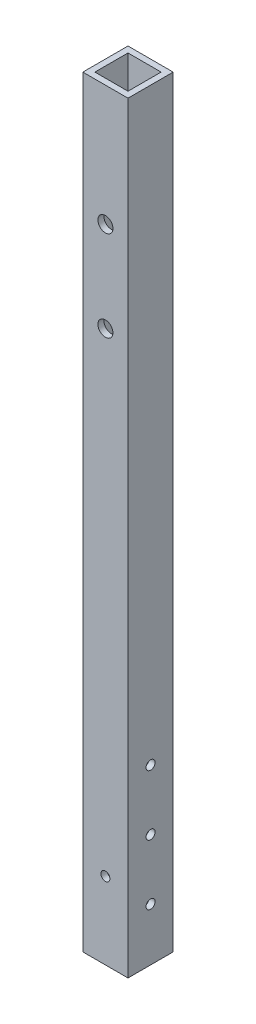
from build123d import *

# Parameters (mm, degrees)
SKETCH_1_W          = 15
SKETCH_1_H          = 15
EXTRUDE_1_DEPTH     = 253
SKETCH_2_W          = 11
SKETCH_2_H          = 11
CUT_EXTRUDE_1_DEPTH = 253
SKETCH_3_R          = 1.5
CUT_EXTRUDE_2_DEPTH = 15
SKETCH_4_R          = 1.5
CUT_EXTRUDE_3_DEPTH = 15
SKETCH_5_R          = 2.5
CUT_EXTRUDE_4_DEPTH = 15


with BuildPart() as part:
    # 草图1 → 凸台-拉伸1 (new body)
    with BuildSketch(Plane(origin=(0, 0, 0), x_dir=(1, 0, 0), z_dir=(0, 1, 0))):
        Rectangle(SKETCH_1_W, SKETCH_1_H)
    extrude(amount=EXTRUDE_1_DEPTH)

    # 草图2 → 切除-拉伸1 (cut)
    with BuildSketch(Plane(origin=(0, 253, 0), x_dir=(1, 0, 0), z_dir=(0, 1, 0))):
        Rectangle(SKETCH_2_W, SKETCH_2_H)
    extrude(amount=-CUT_EXTRUDE_1_DEPTH, mode=Mode.SUBTRACT)

    # 草图3 → 切除-拉伸2 (cut)
    with BuildSketch(Plane(origin=(7.5, 0, 0), x_dir=(0, 0, -1), z_dir=(1, 0, 0))):
        with Locations((0, 17.5)):
            Circle(SKETCH_3_R)
        with Locations((0, 37.5)):
            Circle(SKETCH_3_R)
        with Locations((0, 57.5)):
            Circle(SKETCH_3_R)
    extrude(amount=-CUT_EXTRUDE_2_DEPTH, mode=Mode.SUBTRACT)

    # 草图4 → 切除-拉伸3 (cut)
    with BuildSketch(Plane(origin=(0, 0, -7.5), x_dir=(-1, 0, 0), z_dir=(0, 0, -1))):
        with Locations((0, 25.5)):
            Circle(SKETCH_4_R)
    extrude(amount=-CUT_EXTRUDE_3_DEPTH, mode=Mode.SUBTRACT)

    # 草图5 → 切除-拉伸4 (cut)
    with BuildSketch(Plane(origin=(0, 0, -7.5), x_dir=(-1, 0, 0), z_dir=(0, 0, -1))):
        with Locations((0, 213)):
            Circle(SKETCH_5_R)
        with Locations((0, 183)):
            Circle(SKETCH_5_R)
    extrude(amount=-CUT_EXTRUDE_4_DEPTH, mode=Mode.SUBTRACT)


solid = part.part
